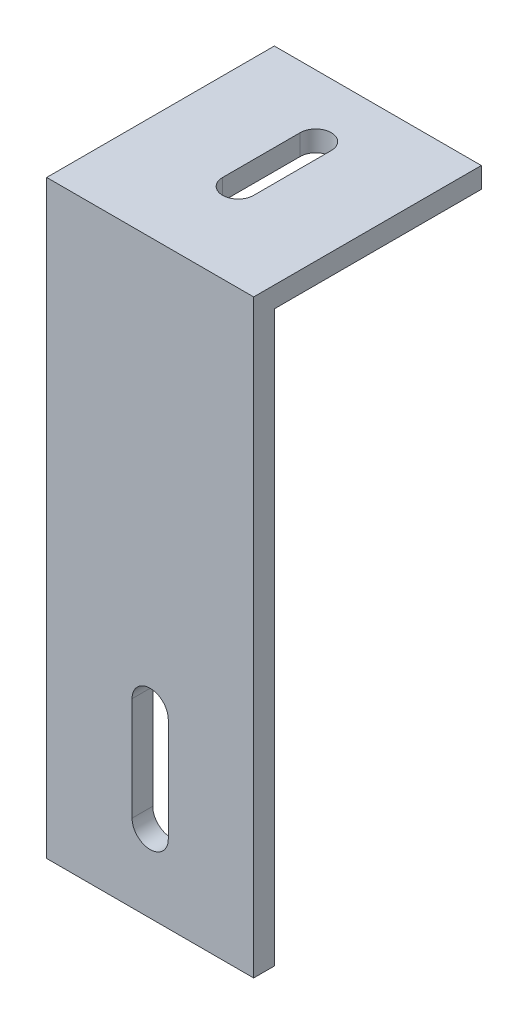
from build123d import *

# Parameters (mm, degrees)
EXTRUDE_1_DEPTH     = 40
CUT_EXTRUDE_1_REACH = 130.577
CUT_EXTRUDE_2_REACH = 130.577


with BuildPart() as part:
    # 草图1 → 凸台-拉伸1 (new body)
    with BuildSketch(Plane(origin=(0, 0, 0), x_dir=(0, 0, -1), z_dir=(1, 0, 0))):
        Polygon((0, 0), (0, 114), (44, 114), (44, 110), (4, 110), (4, 0), align=None)
    extrude(amount=EXTRUDE_1_DEPTH)

    # 草图2 → 切除-拉伸1 (cut, up to next)
    with BuildSketch(Plane(origin=(0, 114, 0), x_dir=(1, 0, 0), z_dir=(0, 1, 0)), mode=Mode.PRIVATE) as cut_extrude_1_sk1:
        with BuildLine():
            Line((17, 32), (17, 17))
            ThreePointArc((17, 17), (20, 14), (23, 17))
            Line((23, 17), (23, 32))
            ThreePointArc((23, 32), (20, 35), (17, 32))
        make_face()
    cut_extrude_1_tool1 = extrude(cut_extrude_1_sk1.sketch, amount=-CUT_EXTRUDE_1_REACH, mode=Mode.PRIVATE) & part.part
    add(cut_extrude_1_tool1.solids().sort_by_distance((20, 114, -24.5))[0], mode=Mode.SUBTRACT)

    # 草图3 → 切除-拉伸2 (cut, up to next)
    with BuildSketch(Plane.XY, mode=Mode.PRIVATE) as cut_extrude_2_sk1:
        with BuildLine():
            Line((23.5, 15), (23.5, 35))
            ThreePointArc((23.5, 35), (20, 38.5), (16.5, 35))
            Line((16.5, 35), (16.5, 15))
            ThreePointArc((16.5, 15), (20, 11.5), (23.5, 15))
        make_face()
    cut_extrude_2_tool1 = extrude(cut_extrude_2_sk1.sketch, amount=-CUT_EXTRUDE_2_REACH, mode=Mode.PRIVATE) & part.part
    add(cut_extrude_2_tool1.solids().sort_by_distance((20, 25, 0))[0], mode=Mode.SUBTRACT)


solid = part.part
